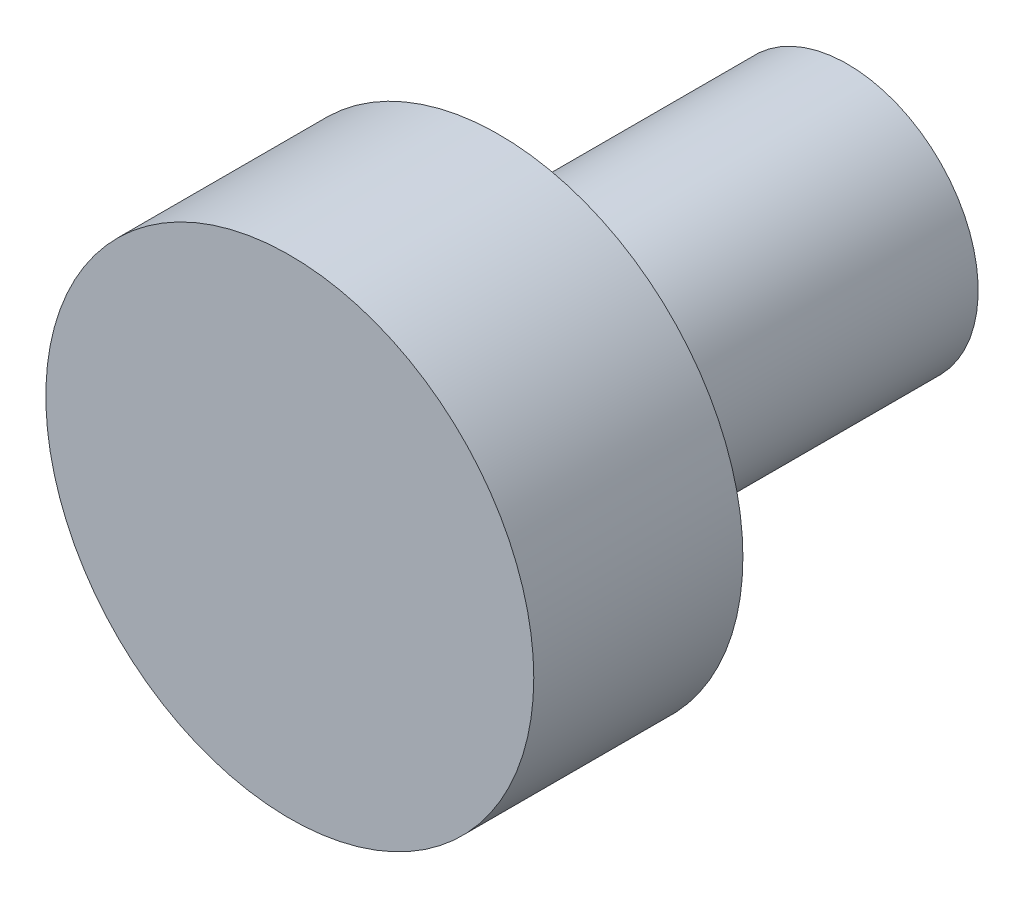
from build123d import *

# Parameters (mm, degrees)
ESQUISSE1_R        = 2.8
BOSS_EXTRU_1_DEPTH = 2.4
ESQUISSE2_R        = 1.5
BOSS_EXTRU_2_DEPTH = 4


with BuildPart() as part:
    # Esquisse1 → Boss.-Extru.1 (new body)
    with BuildSketch(Plane.XY):
        Circle(ESQUISSE1_R)
    extrude(amount=BOSS_EXTRU_1_DEPTH)

    # Esquisse2 → Boss.-Extru.2 (add)
    with BuildSketch(Plane(origin=(0, 0, 0), x_dir=(-1, 0, 0), z_dir=(0, 0, -1))):
        Circle(ESQUISSE2_R)
    extrude(amount=BOSS_EXTRU_2_DEPTH)


solid = part.part
